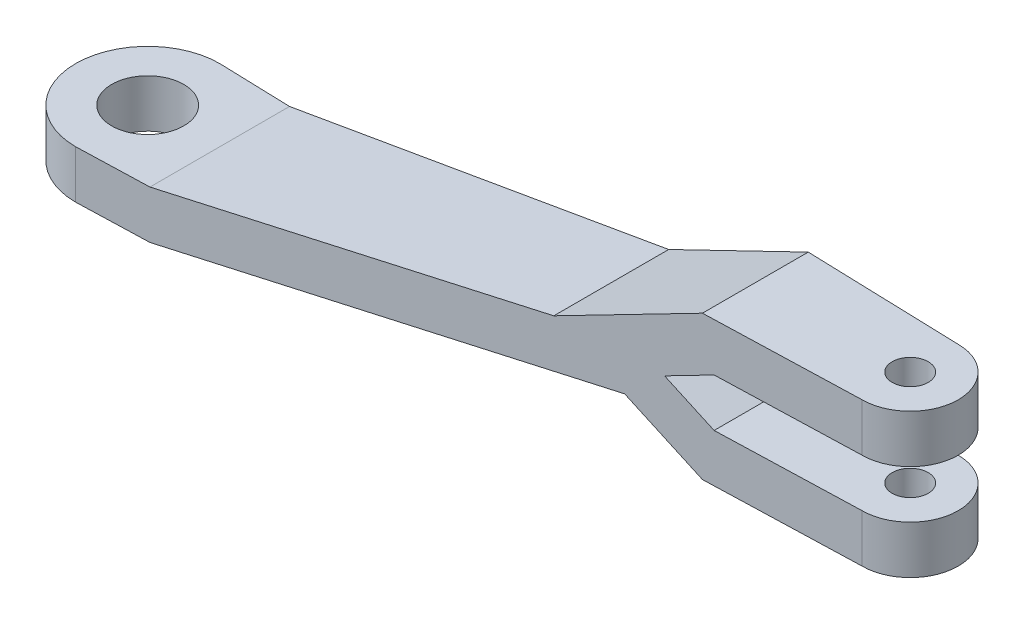
from build123d import *

# Parameters (mm, degrees)
EXTRUDE_1_DEPTH          = 6
EXTRUDE_1_DEPTH_BACK     = 6
SKETCH_1_R               = 1.5
SKETCH_1_R_2             = 0.75
CUT_EXTRUDE_1_DEPTH      = 36.391559728
CUT_EXTRUDE_1_DEPTH_BACK = 36.391559728
SKETCH_2_W               = 62.866350052
SKETCH_2_H               = 37.677296861


with BuildPart() as part:
    # Эскиз1 → Бобышка-Вытянуть1 (new, two sides: drawn at the far end of the back side and taken through both)
    with BuildSketch(Plane(origin=(0, 0, 0), x_dir=(1, 0, 0), z_dir=(0, 1, 0)).offset(-EXTRUDE_1_DEPTH_BACK)):
        with BuildLine():
            Line((0, 2), (-31.75, 3))
            ThreePointArc((-31.75, 3), (-34.75, 0), (-31.75, -3))
            Line((-31.75, -3), (0, -2))
            ThreePointArc((0, -2), (2, 0), (0, 2))
        make_face()
        with Locations((-31.75, 0)):
            Circle(SKETCH_1_R, mode=Mode.SUBTRACT)
        Circle(SKETCH_1_R_2, mode=Mode.SUBTRACT)
    extrude(amount=EXTRUDE_1_DEPTH + EXTRUDE_1_DEPTH_BACK)

    # Эскиз2 → Вырез-Вытянуть1 (cut, two sides: drawn at the far end of the back side and taken through both)
    with BuildSketch(Plane.XY.offset(-CUT_EXTRUDE_1_DEPTH_BACK)):
        with Locations((-15.620530839, 1.877248647)):
            Rectangle(SKETCH_2_W, SKETCH_2_H)
        Polygon((-34.75, -2), (-34.75, -0.25), (-28.75, -0.25), (-12.448133575, 3), (-8.870424812, 4.788854382), (-6.448133576, 6), (-5, 6), (2, 6), (2, 4), (-5.975997621, 4), (-7.975997621, 3), (-5.975997621, 2), (2, 2), (2, 0), (-6.448133576, 0), (-9.588391111, 1.570128768), (-28.75, -2.25), (-34.75, -2.25), align=None, mode=Mode.SUBTRACT)
    extrude(amount=CUT_EXTRUDE_1_DEPTH + CUT_EXTRUDE_1_DEPTH_BACK, mode=Mode.SUBTRACT)


solid = part.part
